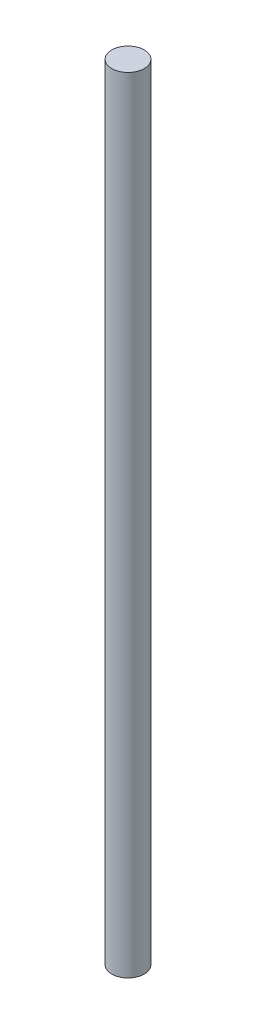
from build123d import *

# Parameters (mm, degrees)
SKETCH1_R           = 2.5
BOSS_EXTRUDE1_DEPTH = 121


with BuildPart() as part:
    # Sketch1 → Boss-Extrude1 (new body)
    with BuildSketch(Plane(origin=(0, 0, 0), x_dir=(1, 0, 0), z_dir=(0, 1, 0))):
        with Locations(Location((0, 0, 0), (0, 0, 270))):
            Circle(SKETCH1_R)
    extrude(amount=BOSS_EXTRUDE1_DEPTH)


solid = part.part
